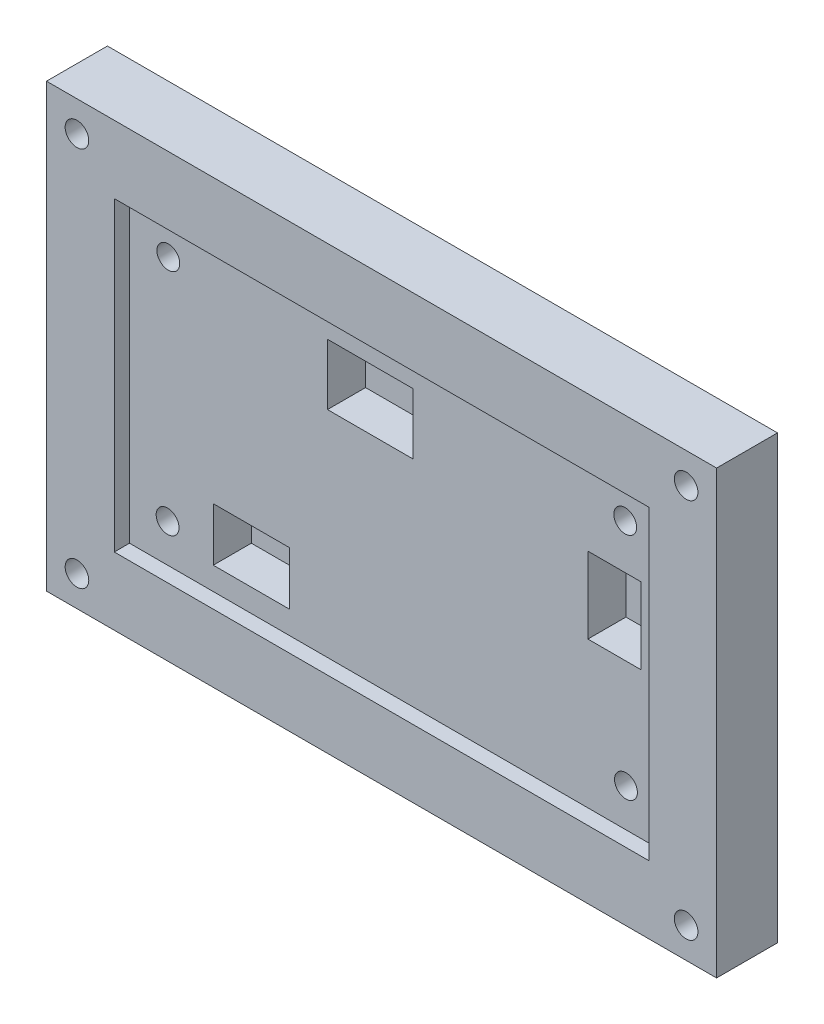
from build123d import *

# Parameters (mm, degrees)
SKETCH_2_W          = 88
SKETCH_2_H          = 58
SKETCH_2_R          = 1.55
EXTRUDE_4_DEPTH     = 8
SKETCH_6_W          = 70.2
SKETCH_6_H          = 40.2
CUT_EXTRUDE_4_DEPTH = 2
SKETCH_7_R          = 1.5
SKETCH_7_W          = 10
SKETCH_7_H          = 7
SKETCH_7_W_2        = 7
SKETCH_7_H_2        = 10
SKETCH_7_W_3        = 11.2
SKETCH_7_H_3        = 8
CUT_EXTRUDE_7_DEPTH = 5


with BuildPart() as part:
    # 草图2 → 凸台-拉伸4 (new body)
    with BuildSketch(Plane.XY):
        with Locations((44, 29)):
            Rectangle(SKETCH_2_W, SKETCH_2_H)
        with Locations((4, 4)):
            Circle(SKETCH_2_R, mode=Mode.SUBTRACT)
        with Locations(Location((4, 54, 0), (0, 0, 180))):
            Circle(SKETCH_2_R, mode=Mode.SUBTRACT)
        with Locations(Location((84, 4, 0), (0, 0, 180))):
            Circle(SKETCH_2_R, mode=Mode.SUBTRACT)
        with Locations((84, 54)):
            Circle(SKETCH_2_R, mode=Mode.SUBTRACT)
    extrude(amount=EXTRUDE_4_DEPTH)

    # 草图6 → 切除-拉伸4 (cut)
    with BuildSketch(Plane.XY.offset(8)):
        with Locations((44, 29)):
            Rectangle(SKETCH_6_W, SKETCH_6_H)
    extrude(amount=-CUT_EXTRUDE_4_DEPTH, mode=Mode.SUBTRACT)

    # 草图7 → 切除-拉伸7 (cut)
    with BuildSketch(Plane.XY.offset(6)):
        with Locations((13.9, 13.9)):
            Circle(SKETCH_7_R)
        with Locations(Location((14, 44, 0), (0, 0, 180))):
            Circle(SKETCH_7_R)
        with Locations(Location((74.1, 13.9, 0), (0, 0, 180))):
            Circle(SKETCH_7_R)
        with Locations((74, 44)):
            Circle(SKETCH_7_R)
        with Locations((24.9, 15.4)):
            Rectangle(SKETCH_7_W, SKETCH_7_H)
        with Locations((72.6, 33.1)):
            Rectangle(SKETCH_7_W_2, SKETCH_7_H_2)
        with Locations((40.5, 41.1)):
            Rectangle(SKETCH_7_W_3, SKETCH_7_H_3)
    extrude(amount=-CUT_EXTRUDE_7_DEPTH, mode=Mode.SUBTRACT)


solid = part.part
